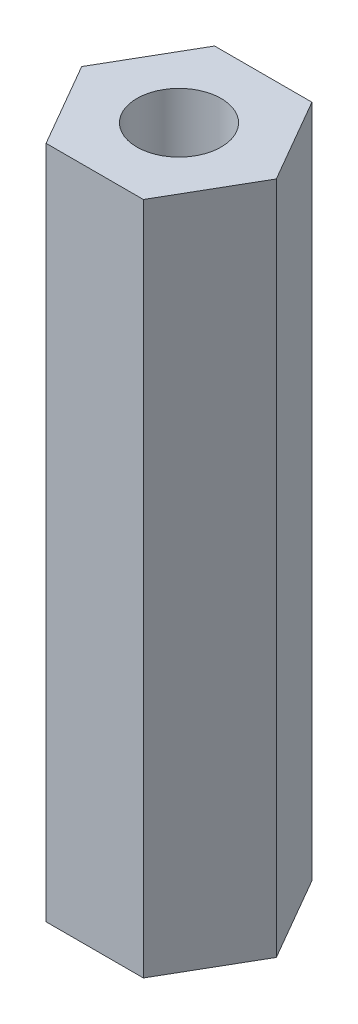
from build123d import *

# Parameters (mm, degrees)
SKETCH1_R           = 3.175
BOSS_EXTRUDE1_DEPTH = 50.8


with BuildPart() as part:
    # Sketch1 → Boss-Extrude1 (new body)
    with BuildSketch(Plane(origin=(0, 0, 0), x_dir=(1, 0, 0), z_dir=(0, 1, 0))):
        Polygon((7.332348419, 0), (3.666174209, 6.35), (-3.666174209, 6.35), (-7.332348419, 0), (-3.666174209, -6.35), (3.666174209, -6.35), align=None)
        with Locations(Location((0, 0, 0), (0, 0, 270))):
            Circle(SKETCH1_R, mode=Mode.SUBTRACT)
    extrude(amount=BOSS_EXTRUDE1_DEPTH)


solid = part.part
